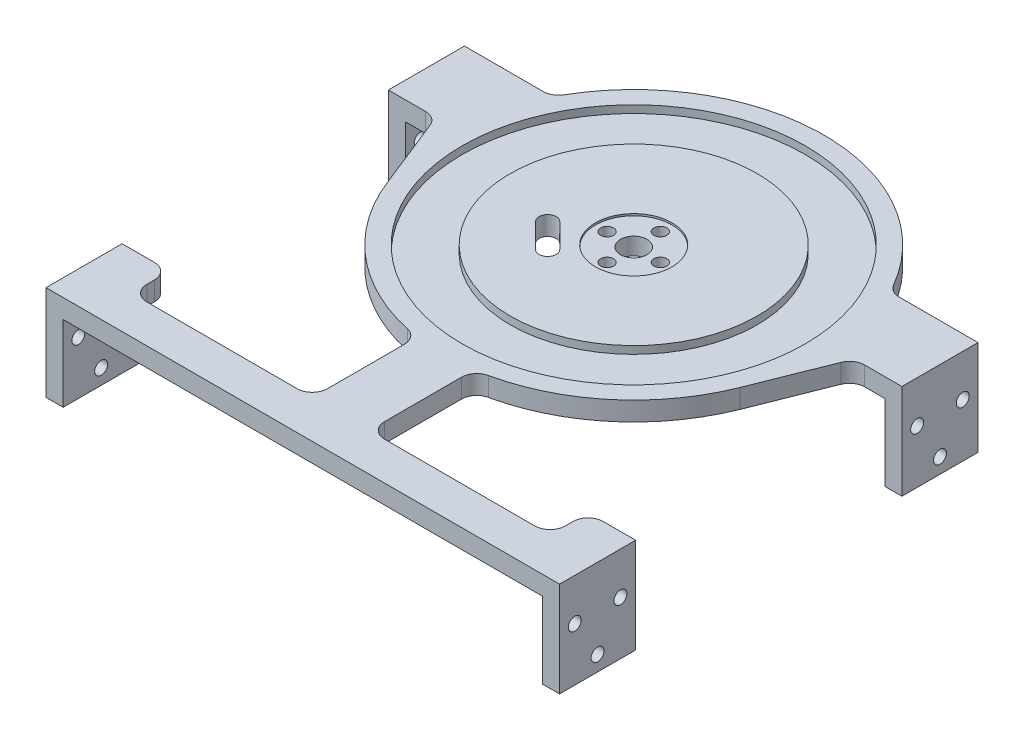
from build123d import *

# Parameters (mm, degrees)
EXTRUDE_1_DEPTH          = 5
SKETCH_2_W               = 20
SKETCH_2_H               = 25
SKETCH_2_R               = 1.7
EXTRUDE_2_DEPTH          = 4.5
MIRROR_2_COPY_1_SKETCH_W = 20
MIRROR_2_COPY_1_SKETCH_H = 25
MIRROR_2_COPY_1_SKETCH_R = 1.7
MIRROR_2_COPY_1_DEPTH    = 4.5
SKETCH_3_R               = 45.1
SKETCH_3_R_2             = 32.45
CUT_EXTRUDE_1_DEPTH      = 2
SKETCH_3_3_R             = 1.7
SKETCH_3_3_R_2           = 3.5
CUT_EXTRUDE_2_DEPTH      = 110.111181828
SKETCH_3_4_R             = 10.05
SKETCH_3_4_R_2           = 1.7
SKETCH_3_4_R_3           = 3.5
CUT_EXTRUDE_3_DEPTH      = 0.5
CUT_EXTRUDE_4_DEPTH      = 110.111181828
FILLET_1_R               = 4


with BuildPart() as part:
    # 草图1 → 凸台-拉伸1 (new body)
    with BuildSketch(Plane(origin=(0, 0, 0), x_dir=(1, 0, 0), z_dir=(0, 1, 0))):
        with BuildLine():
            Line((-63, 55), (-63, 35))
            Line((-63, 35), (-55, 35))
            Line((-55, 35), (-46.462183916, 13.526628199))
            ThreePointArc((-46.462183916, 13.526628199), (-31.106656674, -7.145573321), (-7.5, -17.434299833))
            Line((-7.5, -17.434299833), (-7.5, -45))
            Line((-7.5, -45), (-55, -45))
            Line((-55, -45), (-55, -35))
            Line((-55, -35), (-63, -35))
            Line((-63, -35), (-63, -55))
            Line((-63, -55), (63, -55))
            Line((63, -55), (63, -35))
            Line((63, -35), (55, -35))
            Line((55, -35), (55, -45))
            Line((55, -45), (7.5, -45))
            Line((7.5, -45), (7.5, -17.434299833))
            ThreePointArc((7.5, -17.434299833), (31.106656674, -7.145573321), (46.462183916, 13.526628199))
            Line((46.462183916, 13.526628199), (55, 35))
            Line((55, 35), (63, 35))
            Line((63, 35), (63, 55))
            Line((63, 55), (44.395945761, 55))
            ThreePointArc((44.395945761, 55), (0, 82), (-44.395945761, 55))
            Line((-44.395945761, 55), (-63, 55))
        make_face()
    extrude(amount=EXTRUDE_1_DEPTH)

    # 草图2 → 凸台-拉伸2 (add)
    with BuildSketch(Plane(origin=(63, 0, 0), x_dir=(0, 0, -1), z_dir=(1, 0, 0))):
        with Locations((45, -7.5)):
            Rectangle(SKETCH_2_W, SKETCH_2_H)
        with Locations((51, -6)):
            Circle(SKETCH_2_R, mode=Mode.SUBTRACT)
        with Locations((45, -16)):
            Circle(SKETCH_2_R, mode=Mode.SUBTRACT)
        with Locations((39, -6)):
            Circle(SKETCH_2_R, mode=Mode.SUBTRACT)
    extrude_2 = extrude(amount=EXTRUDE_2_DEPTH)

    # 镜向1: 凸台-拉伸2 across plane
    add(extrude_2.mirror(Plane.XY))

    # 镜向2: 凸台-拉伸2 across plane
    add(extrude_2.mirror(Plane(origin=(0, 0, 0), x_dir=(0, 0, 1), z_dir=(1, 0, 0))))

    # 镜向2 copy 1 sketch → 镜向2 copy 1 (add)
    with BuildSketch(Plane.ZY.offset(63)):
        with Locations((45, -7.5)):
            Rectangle(MIRROR_2_COPY_1_SKETCH_W, MIRROR_2_COPY_1_SKETCH_H)
        with Locations((51, -6)):
            Circle(MIRROR_2_COPY_1_SKETCH_R, mode=Mode.SUBTRACT)
        with Locations((45, -16)):
            Circle(MIRROR_2_COPY_1_SKETCH_R, mode=Mode.SUBTRACT)
        with Locations((39, -6)):
            Circle(MIRROR_2_COPY_1_SKETCH_R, mode=Mode.SUBTRACT)
    extrude(amount=MIRROR_2_COPY_1_DEPTH)

    # 草图3 → 切除-拉伸1 (cut)
    with BuildSketch(Plane(origin=(0, 5, 0), x_dir=(1, 0, 0), z_dir=(0, 1, 0))):
        with Locations((0, 32)):
            Circle(SKETCH_3_R)
        with Locations((0, 32)):
            Circle(SKETCH_3_R_2, mode=Mode.SUBTRACT)
    extrude(amount=-CUT_EXTRUDE_1_DEPTH, mode=Mode.SUBTRACT)

    # 草图3<3> → 切除-拉伸2 (cut, through all)
    with BuildSketch(Plane(origin=(0, 5, 0), x_dir=(1, 0, 0), z_dir=(0, 1, 0))):
        with Locations((0, 39)):
            Circle(SKETCH_3_3_R)
        with Locations((7, 32)):
            Circle(SKETCH_3_3_R)
        with Locations((0, 25)):
            Circle(SKETCH_3_3_R)
        with Locations((-7, 32)):
            Circle(SKETCH_3_3_R)
        with Locations((0, 32)):
            Circle(SKETCH_3_3_R_2)
    extrude(amount=-CUT_EXTRUDE_2_DEPTH, mode=Mode.SUBTRACT)

    # 草图3<4> → 切除-拉伸3 (cut)
    with BuildSketch(Plane(origin=(0, 5, 0), x_dir=(1, 0, 0), z_dir=(0, 1, 0))):
        with Locations((0, 32)):
            Circle(SKETCH_3_4_R)
        with Locations((0, 25)):
            Circle(SKETCH_3_4_R_2, mode=Mode.SUBTRACT)
        with Locations((-7, 32)):
            Circle(SKETCH_3_4_R_2, mode=Mode.SUBTRACT)
        with Locations((0, 39)):
            Circle(SKETCH_3_4_R_2, mode=Mode.SUBTRACT)
        with Locations((0, 32)):
            Circle(SKETCH_3_4_R_3, mode=Mode.SUBTRACT)
        with Locations((7, 32)):
            Circle(SKETCH_3_4_R_2, mode=Mode.SUBTRACT)
    extrude(amount=-CUT_EXTRUDE_3_DEPTH, mode=Mode.SUBTRACT)

    # 草图4 → 切除-拉伸4 (cut, through all)
    with BuildSketch(Plane(origin=(0, 5, 0), x_dir=(1, 0, 0), z_dir=(0, 1, 0))):
        with BuildLine():
            Line((-8.66205807, 21.216621587), (-15.0260191, 27.580582618))
            ThreePointArc((-15.0260191, 27.580582618), (-18.207999616, 27.580582618), (-18.207999616, 24.398602102))
            Line((-18.207999616, 24.398602102), (-11.844038585, 18.034641072))
            ThreePointArc((-11.844038585, 18.034641072), (-8.66205807, 18.034641072), (-8.66205807, 21.216621587))
        make_face()
    extrude(amount=-CUT_EXTRUDE_4_DEPTH, mode=Mode.SUBTRACT)

    # 圆角1
    fillet_1_edges = [part.edges().sort_by_distance(p)[0] for p in [
        (55, 2.5, -35),
        (55, 2.5, 35),
        (55, 2.5, 45),
        (7.5, 2.5, 17.434299833),
        (7.5, 2.5, 45),
        (-55, 2.5, 35),
        (-55, 2.5, 45),
        (-7.5, 2.5, 45),
        (-7.5, 2.5, 17.434299833),
        (-55, 2.5, -35),
        (-44.395945761, 2.5, -55),
        (44.395945761, 2.5, -55),
    ]]
    fillet(fillet_1_edges, radius=FILLET_1_R)


solid = part.part
